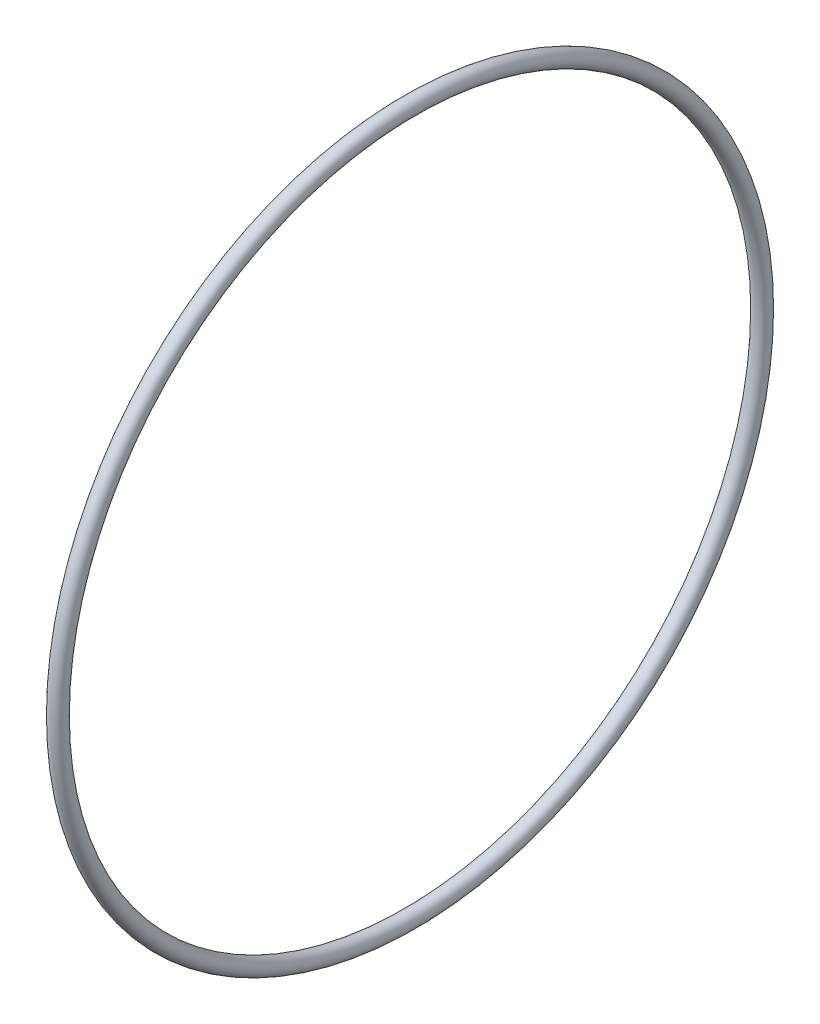
from build123d import *

# Parameters (mm, degrees)
SKETCH3_R = 1


with BuildPart() as part:
    # Sketch3 → Revolve1 (revolve)
    with BuildSketch(Plane(origin=(0, 0, 0), x_dir=(-1, 0, 0), z_dir=(0, 0, -1))):
        with Locations((0, 43.5)):
            Circle(SKETCH3_R)
    revolve(axis=Axis((0, 0, 0), (-1, 0, 0)))


solid = part.part
